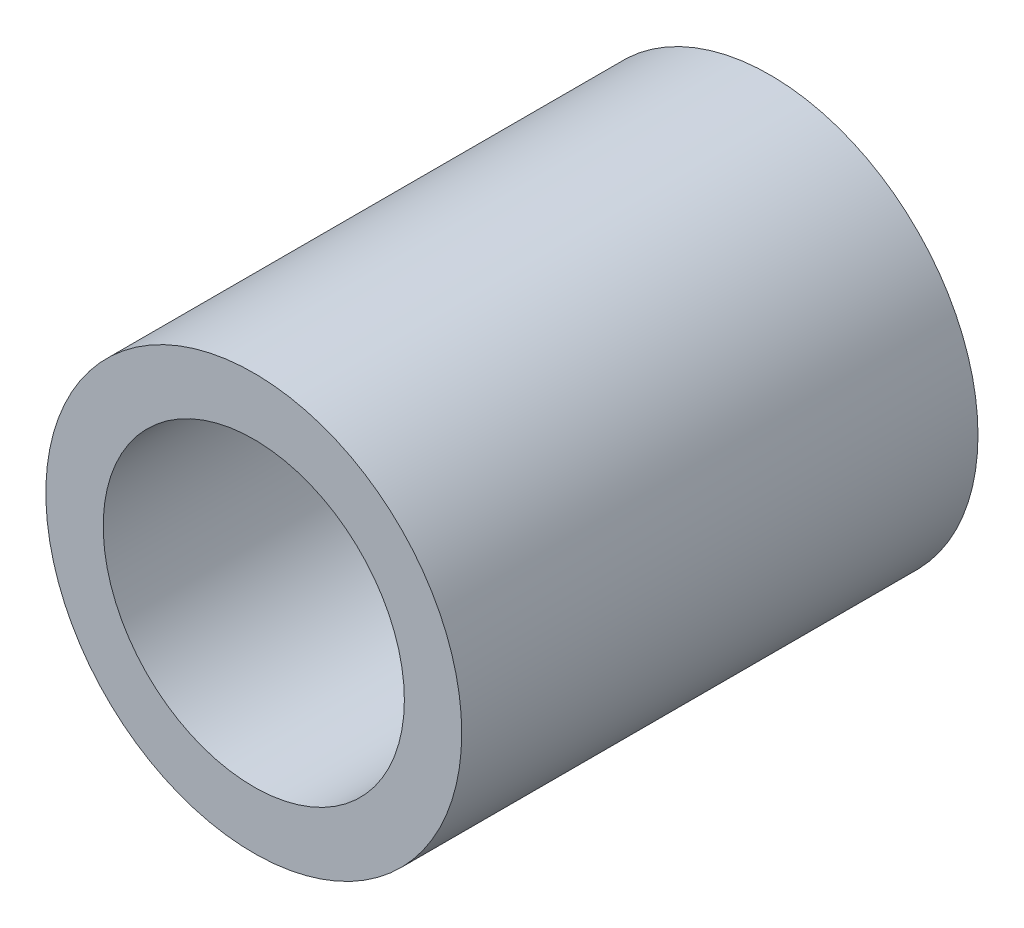
from build123d import *

# Parameters (mm, degrees)
SZKIC1_R                    = 7.25
SZKIC1_R_2                  = 5.25
DODANIE_WYCI_GNI_CIE1_DEPTH = 18


with BuildPart() as part:
    # Szkic1 → Dodanie-wyciągnięcie1 (new body)
    with BuildSketch(Plane.XY):
        with Locations((-4.435638638, 1.804768885)):
            Circle(SZKIC1_R)
        with Locations((-4.435638638, 1.804768885)):
            Circle(SZKIC1_R_2, mode=Mode.SUBTRACT)
    extrude(amount=DODANIE_WYCI_GNI_CIE1_DEPTH)


solid = part.part
